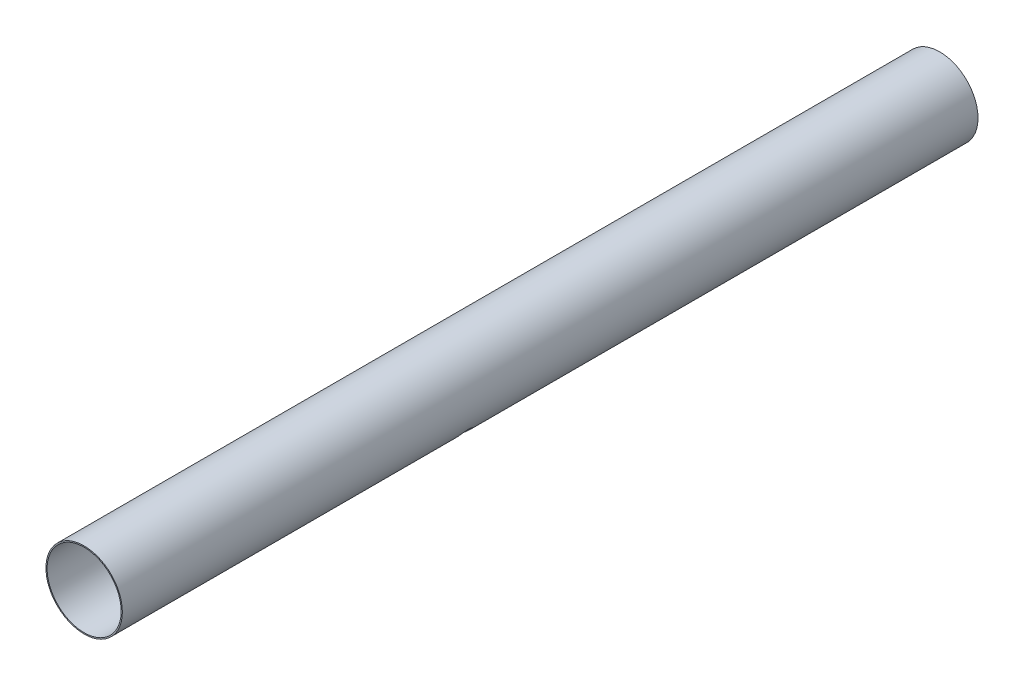
from build123d import *

# Parameters (mm, degrees)
SKETCH1_R           = 78.6
SKETCH1_R_2         = 76.2
BOSS_EXTRUDE1_DEPTH = 1760
SKETCH5_R           = 15
CUT_EXTRUDE2_DEPTH  = 1764.506711073


with BuildPart() as part:
    # Sketch1 → Boss-Extrude1 (new body)
    with BuildSketch(Plane.XY):
        Circle(SKETCH1_R)
        Circle(SKETCH1_R_2, mode=Mode.SUBTRACT)
    extrude(amount=BOSS_EXTRUDE1_DEPTH)

    # Sketch5 → Cut-Extrude2 (cut, through all)
    with BuildSketch(Plane(origin=(0, 0, 0), x_dir=(0, 0, -1), z_dir=(0.7071067811865489, -0.7071067811865462, 0))):
        with Locations(Location((-1034.89, 0, 0), (0, 0, 270))):
            Circle(SKETCH5_R)
    extrude(amount=CUT_EXTRUDE2_DEPTH, mode=Mode.SUBTRACT)


solid = part.part
